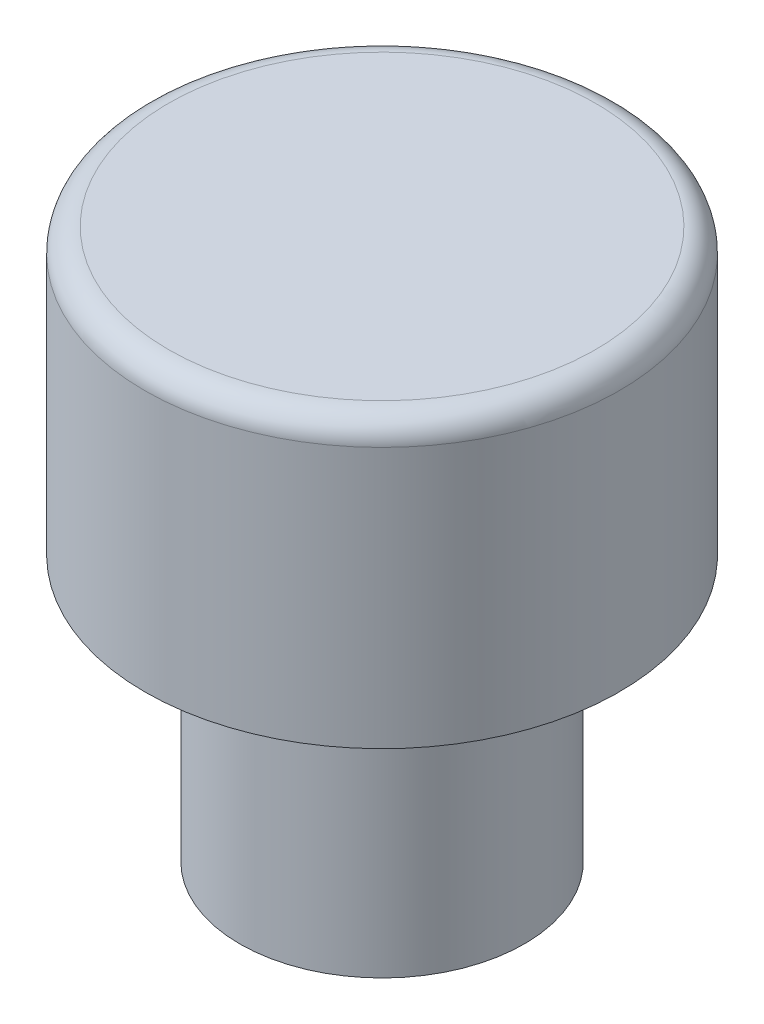
from build123d import *

# Parameters (mm, degrees)
SKETCH1_R          = 3
STEM_HOUSING_DEPTH = 5.6
SKETCH2_R          = 5
BUTTON_HEAD_DEPTH  = 6
FILLET1_R          = 0.5


with BuildPart() as part:
    # Sketch1 → stem housing (new body)
    with BuildSketch(Plane(origin=(0, 0, 0), x_dir=(1, 0, 0), z_dir=(0, 1, 0))):
        with Locations(Location((0, 0, 0), (0, 0, 270))):
            Circle(SKETCH1_R)
        with BuildLine():
            Line((-0.585, 0.885), (-0.585, 2.05))
            Line((-0.585, 2.05), (0.585, 2.05))
            Line((0.585, 2.05), (0.585, 0.885))
            ThreePointArc((0.585, 0.885), (0.672867966, 0.672867966), (0.885, 0.585))
            Line((0.885, 0.585), (2.05, 0.585))
            Line((2.05, 0.585), (2.05, -0.585))
            Line((2.05, -0.585), (0.885, -0.585))
            ThreePointArc((0.885, -0.585), (0.672867966, -0.672867966), (0.585, -0.885))
            Line((0.585, -0.885), (0.585, -2.05))
            Line((0.585, -2.05), (-0.585, -2.05))
            Line((-0.585, -2.05), (-0.585, -0.885))
            ThreePointArc((-0.585, -0.885), (-0.672867966, -0.672867966), (-0.885, -0.585))
            Line((-0.885, -0.585), (-2.05, -0.585))
            Line((-2.05, -0.585), (-2.05, 0.585))
            Line((-2.05, 0.585), (-0.885, 0.585))
            ThreePointArc((-0.885, 0.585), (-0.672867966, 0.672867966), (-0.585, 0.885))
        make_face(mode=Mode.SUBTRACT)
    extrude(amount=STEM_HOUSING_DEPTH)

    # Sketch2 → button head (add)
    with BuildSketch(Plane(origin=(0, 5.6, 0), x_dir=(1, 0, 0), z_dir=(0, 1, 0))):
        with Locations(Location((0, 0, 0), (0, 0, 270))):
            Circle(SKETCH2_R)
    extrude(amount=BUTTON_HEAD_DEPTH)

    # Fillet1
    fillet1_edges = [part.edges().sort_by_distance(p)[0] for p in [
        (0, 11.6, -5),
    ]]
    fillet(fillet1_edges, radius=FILLET1_R)


solid = part.part
